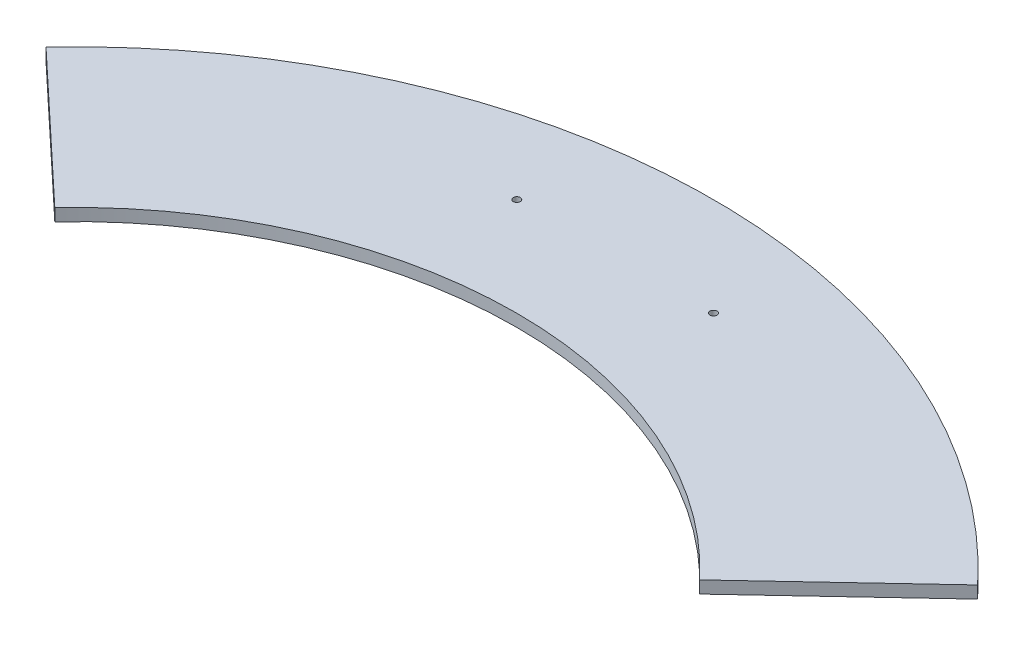
from build123d import *

# Parameters (mm, degrees)
BOSS_EXTRUDE1_DEPTH       = 6.35
F_6_CLEARANCE_HOLE1_D     = 3.6576
F_6_CLEARANCE_HOLE1_DEPTH = 25.4
F_6_CLEARANCE_HOLE1_TIP   = 1.0988539


with BuildPart() as part:
    # Sketch1 → Boss-Extrude1 (new body)
    with BuildSketch(Plane(origin=(0, 0, 0), x_dir=(1, 0, 0), z_dir=(0, 1, 0))):
        with BuildLine():
            Line((166.494481955, 130.873744419), (240.574340444, 200.406))
            ThreePointArc((240.574340444, 200.406), (0, 304.546), (-240.574340444, 200.406))
            Line((-240.574340444, 200.406), (-166.494481955, 130.873744419))
            ThreePointArc((-166.494481955, 130.873744419), (0, 202.946), (166.494481955, 130.873744419))
        make_face()
    extrude(amount=BOSS_EXTRUDE1_DEPTH)

    # #6 Clearance Hole1
    with Locations(Plane(origin=(-50.8, 6.35, -253.746255929), x_dir=(0, 0, 1), z_dir=(0, 1, 0))):
        with Locations((0, 0), (0, 101.6)):
            Hole(F_6_CLEARANCE_HOLE1_D / 2, depth=F_6_CLEARANCE_HOLE1_DEPTH)
            with Locations((0, 0, -(F_6_CLEARANCE_HOLE1_DEPTH + F_6_CLEARANCE_HOLE1_TIP / 2))):  # 118° drill point
                Cone(0, F_6_CLEARANCE_HOLE1_D / 2, F_6_CLEARANCE_HOLE1_TIP, mode=Mode.SUBTRACT)


solid = part.part
